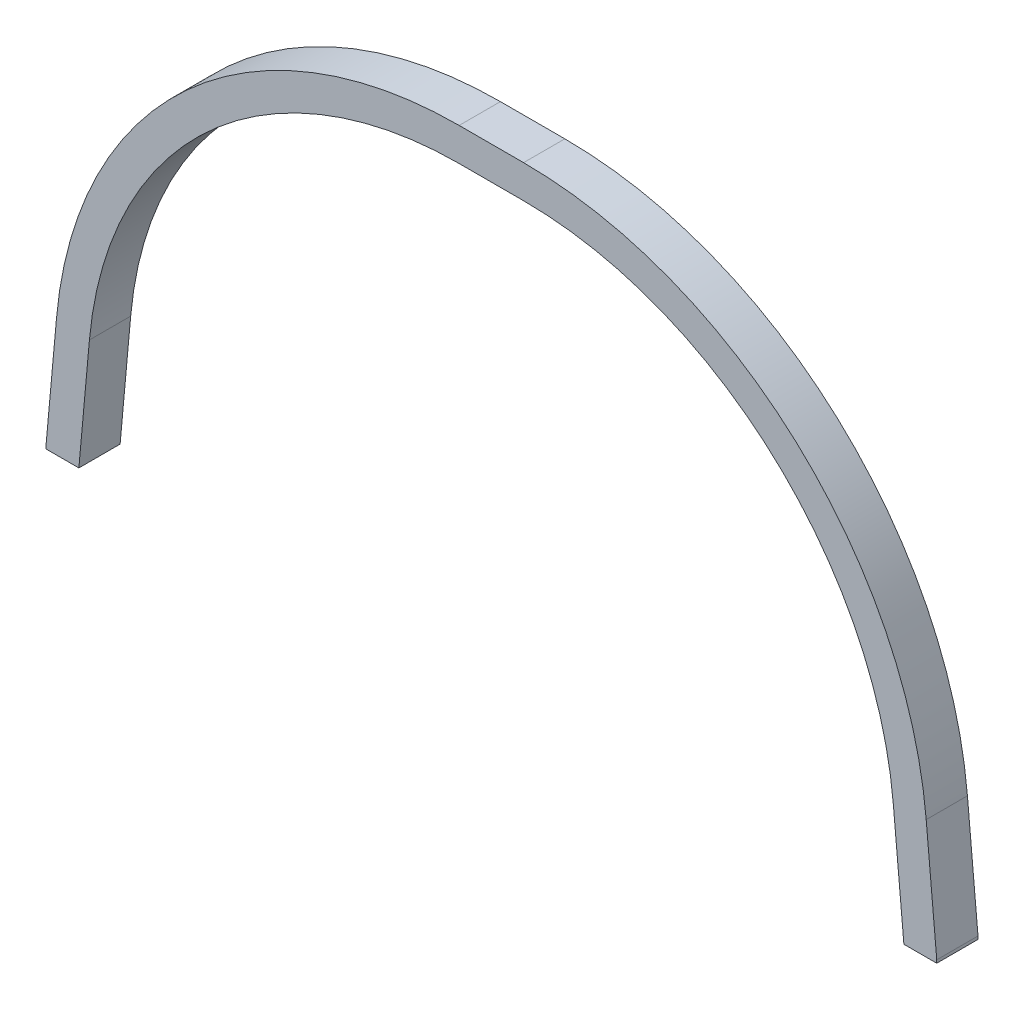
from build123d import *

# Parameters (mm, degrees)
EXTRUDE_1_DEPTH      = 5
SKETCH_3_W           = 25
SKETCH_3_H           = 3
SKETCH_3_W_2         = 27.5
CUT_EXTRUDE_1_DEPTH  = 396.82192966
SKETCH_2_R           = 1
CUT_EXTRUDE_2_DEPTH  = 396.82192966
SKETCH_4_R           = 1
CUT_EXTRUDE_3_DEPTH  = 396.82192966
SKETCH_5_W           = 3
SKETCH_5_H           = 20
CUT_EXTRUDE_4_DEPTH  = 396.82192966
SKETCH_6_W           = 52.963954937
SKETCH_6_H           = 5
SKETCH_6_W_2         = 50.247879271
CUT_EXTRUDE_5_DEPTH  = 396.82192966
SKETCH_7_W           = 24.499878537
SKETCH_7_H           = 5
SKETCH_7_W_2         = 25.63433041
SKETCH_7_W_3         = 30.65568147
SKETCH_7_W_4         = 13.75
CUT_EXTRUDE_6_DEPTH  = 396.82192966
CUT_EXTRUDE_10_DEPTH = 396.82192966
SKETCH_12_W          = 10
SKETCH_12_H          = 114.036005351
CUT_EXTRUDE_11_DEPTH = 396.82192966
SKETCH_13_W          = 5
SKETCH_13_H          = 15
EXTRUDE_2_DEPTH      = 3
CUT_EXTRUDE_12_DEPTH = 396.82192966
FILLET_1_R           = 45
CUT_EXTRUDE_13_DEPTH = 396.82192966


with BuildPart() as part:
    # 草图1 → 凸台-拉伸1 (new body)
    with BuildSketch(Plane.XY):
        Polygon((0, 0), (0, 85), (110, 105), (125, 175), (355, 175), (355, 0), (317.5, 0), (317.5, 5), (312.5, 60), (222.5, 60), (217.5, 5), (217.5, 0), (137.5, 0), (137.5, 5), (132.5, 60), (42.5, 60), (37.5, 5), (37.5, 0), align=None)
    extrude(amount=EXTRUDE_1_DEPTH)

    # 草图3 → 切除-拉伸1 (cut, through all)
    with BuildSketch(Plane.XY.offset(5)):
        with Locations((180, 173.5)):
            Rectangle(SKETCH_3_W, SKETCH_3_H)
        with Locations((341.25, 173.5)):
            Rectangle(SKETCH_3_W_2, SKETCH_3_H)
        with Locations((220, 173.5)):
            Rectangle(SKETCH_3_W, SKETCH_3_H)
        with Locations((260, 173.5)):
            Rectangle(SKETCH_3_W, SKETCH_3_H)
        with Locations((300, 173.5)):
            Rectangle(SKETCH_3_W, SKETCH_3_H)
        Polygon((152.5, 175), (152.5, 172), (124.357142857, 172), (125, 175), align=None)
    extrude(amount=-CUT_EXTRUDE_1_DEPTH, mode=Mode.SUBTRACT)

    # 草图2 → 切除-拉伸2 (cut, through all)
    with BuildSketch(Plane.XY.offset(5)):
        with Locations((200, 173)):
            Circle(SKETCH_2_R)
        with Locations((240, 173)):
            Circle(SKETCH_2_R)
        with Locations((280, 173)):
            Circle(SKETCH_2_R)
        with Locations((320, 173)):
            Circle(SKETCH_2_R)
        with Locations((160, 173)):
            Circle(SKETCH_2_R)
    extrude(amount=-CUT_EXTRUDE_2_DEPTH, mode=Mode.SUBTRACT)

    # 草图4 → 切除-拉伸3 (cut, through all)
    with BuildSketch(Plane.XY.offset(5)):
        with Locations((353, 162)):
            Circle(SKETCH_4_R)
        with Locations((353, 122)):
            Circle(SKETCH_4_R)
        with Locations((353, 82)):
            Circle(SKETCH_4_R)
        with Locations((353, 42)):
            Circle(SKETCH_4_R)
    extrude(amount=-CUT_EXTRUDE_3_DEPTH, mode=Mode.SUBTRACT)

    # 草图5 → 切除-拉伸4 (cut, through all)
    with BuildSketch(Plane.XY.offset(5)):
        with Locations((353.5, 142)):
            Rectangle(SKETCH_5_W, SKETCH_5_H)
        with Locations((353.5, 102)):
            Rectangle(SKETCH_5_W, SKETCH_5_H)
        with Locations((353.5, 62)):
            Rectangle(SKETCH_5_W, SKETCH_5_H)
        with Locations((353.5, 22)):
            Rectangle(SKETCH_5_W, SKETCH_5_H)
    extrude(amount=-CUT_EXTRUDE_4_DEPTH, mode=Mode.SUBTRACT)

    # 草图6 → 切除-拉伸5 (cut, through all)
    with BuildSketch(Plane.XY.offset(5)):
        with Locations((136.018022532, 2.5)):
            Rectangle(SKETCH_6_W, SKETCH_6_H)
        with Locations((217.623939635, 2.5)):
            Rectangle(SKETCH_6_W_2, SKETCH_6_H)
    extrude(amount=-CUT_EXTRUDE_5_DEPTH, mode=Mode.SUBTRACT)

    # 草图7 → 切除-拉伸6 (cut, through all)
    with BuildSketch(Plane.XY.offset(5)):
        with Locations((1.500060731, 2.5)):
            Rectangle(SKETCH_7_W, SKETCH_7_H)
        with Locations((36.567165205, 2.5)):
            Rectangle(SKETCH_7_W_2, SKETCH_7_H)
        with Locations((315.922159265, 2.5)):
            Rectangle(SKETCH_7_W_3, SKETCH_7_H)
        with Locations((348.125, 2.5)):
            Rectangle(SKETCH_7_W_4, SKETCH_7_H)
    extrude(amount=-CUT_EXTRUDE_6_DEPTH, mode=Mode.SUBTRACT)

    # 草图11 → 切除-拉伸10 (cut, through all)
    with BuildSketch(Plane.XY.offset(5)):
        Polygon((114.275152951, 110.632892707), (111.341745709, 111.261479973), (123.075374677, 166.018415161), (126.00878192, 165.389827895), align=None)
    extrude(amount=-CUT_EXTRUDE_10_DEPTH, mode=Mode.SUBTRACT)

    # 草图12 → 切除-拉伸11 (cut, through all)
    with BuildSketch(Plane.XY.offset(5)):
        with Locations((5, 77.018002676)):
            Rectangle(SKETCH_12_W, SKETCH_12_H)
    extrude(amount=-CUT_EXTRUDE_11_DEPTH, mode=Mode.SUBTRACT)

    # 草图13 → 凸台-拉伸2 (add)
    with BuildSketch(Plane.XY.offset(5)):
        with Locations((7.5, 37.5)):
            Rectangle(SKETCH_13_W, SKETCH_13_H)
        with Locations((7.5, 67.5)):
            Rectangle(SKETCH_13_W, SKETCH_13_H)
    extrude(amount=-EXTRUDE_2_DEPTH)

    # 草图15 → 切除-拉伸12 (cut, through all)
    with BuildSketch(Plane.XY.offset(5)):
        Polygon((35.491174943, 86.370968223), (34.596747752, 91.290317773), (19.838699101, 88.6070362), (20.733126292, 83.68768665), align=None)
        Polygon((54.274145954, 94.868026537), (55.168573145, 89.948676987), (69.926621797, 92.63195856), (69.032194606, 97.55130811), align=None)
        Polygon((88.709592808, 101.129016874), (89.604019999, 96.209667324), (104.36206865, 98.892948897), (103.467641459, 103.812298447), align=None)
    extrude(amount=-CUT_EXTRUDE_12_DEPTH, mode=Mode.SUBTRACT)

    # 圆角1
    fillet_1_edges = [part.edges().sort_by_distance(p)[0] for p in [
        (312.5, 60, 2.5),
        (222.5, 60, 2.5),
        (132.5, 60, 2.5),
        (42.5, 60, 2.5),
    ]]
    fillet(fillet_1_edges, radius=FILLET_1_R)

    # 草图16 → 切除-拉伸13 (cut, through all)
    with BuildSketch(Plane.XY.offset(5)):
        with BuildLine():
            Line((33.516427174, 5), (33.516427174, 5.362142984))
            Line((33.516427174, 5.362142984), (34.79589159, 19.436251556))
            ThreePointArc((34.79589159, 19.436251556), (50.552082583, 51.182705304), (83.594658707, 64))
            Line((83.594658707, 64), (91.405341293, 64))
            ThreePointArc((91.405341293, 64), (124.447917417, 51.182705304), (140.20410841, 19.436251556))
            Line((140.20410841, 19.436251556), (141.483572826, 5.362142984))
            Line((141.483572826, 5.362142984), (141.483572826, 5))
            Line((141.483572826, 5), (162.5, 0))
            Line((162.5, 0), (192.5, 0))
            Line((192.5, 0), (217.5, 5))
            Line((217.5, 5), (317.5, 5))
            Line((317.5, 5), (331.25, 0))
            Line((331.25, 0), (341.25, 0))
            Line((341.25, 0), (355, 5))
            Line((355, 5), (355, 172))
            Line((355, 172), (327.5, 175))
            Line((327.5, 175), (152.5, 175))
            Line((152.5, 175), (124.357142857, 172))
            Line((124.357142857, 172), (88.709592808, 101.129016874))
            Line((88.709592808, 101.129016874), (10, 86.818181818))
            Line((10, 86.818181818), (5, 75))
            Line((5, 75), (0, 20))
            Line((0, 20), (0, 5))
            Line((0, 5), (13.75, 0))
            Line((13.75, 0), (23.75, 0))
            Line((23.75, 0), (33.516427174, 5))
        make_face()
    extrude(amount=-CUT_EXTRUDE_13_DEPTH, mode=Mode.SUBTRACT)


solid = part.part
